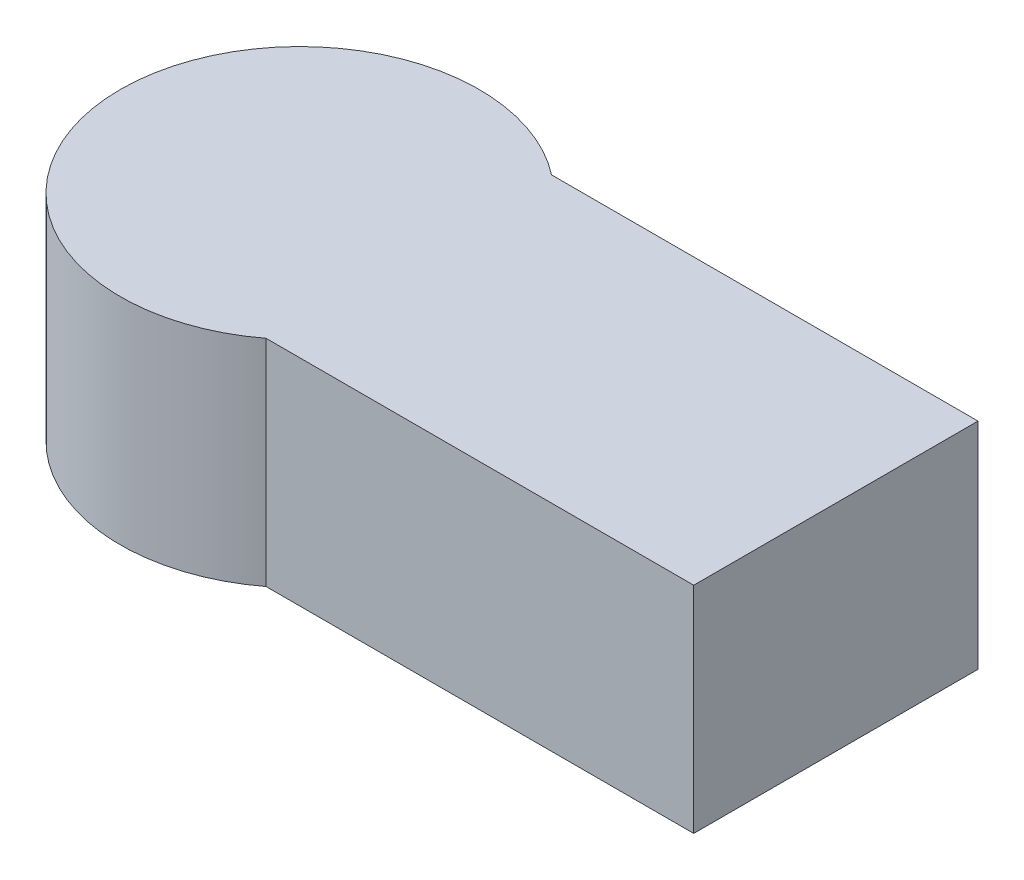
from build123d import *
from build123d.topology import SkipClean

# Parameters (mm, degrees)
SALIENTE_EXTRUIR1_DEPTH = 65
SALIENTE_EXTRUIR2_DEPTH = 2.5
CROQUIS4_W              = 101
CROQUIS4_H              = 10
CORTAR_EXTRUIR1_DEPTH   = 250
SALIENTE_EXTRUIR3_DEPTH = 3


with BuildPart() as part:
    # Croquis2 → Saliente-Extruir1 (new body)
    with BuildSketch(Plane(origin=(0, 0, 0), x_dir=(1, 0, 0), z_dir=(0, 1, 0))):
        with BuildLine():
            Line((151, 39.865398531), (31, 39.865398531))
            ThreePointArc((31, 39.865398531), (-50.499518563, 0.220510468), (30.650673156, -40.134601469))
            Line((30.650673156, -40.134601469), (151, -40.134601469))
            Line((151, -40.134601469), (151, 39.865398531))
        make_face()
        with BuildLine():
            Line((30.655028903, 38.865398531), (150, 38.865398531))
            Line((150, 38.865398531), (150, -39.134601469))
            Line((150, -39.134601469), (30.310608173, -39.134601469))
            ThreePointArc((30.310608173, -39.134601469), (-49.499517432, 0.218572563), (30.655028903, 38.865398531))
        make_face(mode=Mode.SUBTRACT)
    extrude(amount=SALIENTE_EXTRUIR1_DEPTH)

    # Croquis3 → Saliente-Extruir2 (add)
    with SkipClean():  # the faces are left unmerged after this step: merging them gives an invalid solid
        with BuildSketch(Plane(origin=(0, 65, 0), x_dir=(1, 0, 0), z_dir=(0, 1, 0))):
            with BuildLine():
                Line((151, 39.865398531), (151, -40.134601469))
                Line((151, -40.134601469), (30.650673156, -40.134601469))
                ThreePointArc((30.650673156, -40.134601469), (-50.499518563, 0.220510468), (31, 39.865398531))
                Line((31, 39.865398531), (151, 39.865398531))
            make_face()
        extrude(amount=SALIENTE_EXTRUIR2_DEPTH)

    # Croquis4 → Cortar-Extruir1 (cut)
    with BuildSketch(Plane(origin=(151, 0, 0), x_dir=(0, 0, -1), z_dir=(1, 0, 0))):
        with Locations((0, 62.5)):
            Rectangle(CROQUIS4_W, CROQUIS4_H)
    extrude(amount=-CORTAR_EXTRUIR1_DEPTH, mode=Mode.SUBTRACT)

    # Croquis5 → Saliente-Extruir3 (add)
    with BuildSketch(Plane(origin=(0, 57.5, 0), x_dir=(1, 0, 0), z_dir=(0, 1, 0))):
        with BuildLine():
            Line((151, 39.865398531), (31, 39.865398531))
            ThreePointArc((31, 39.865398531), (-50.499518563, 0.220510468), (30.650673156, -40.134601469))
            Line((30.650673156, -40.134601469), (151, -40.134601469))
            Line((151, -40.134601469), (151, 39.865398531))
        make_face()
    extrude(amount=SALIENTE_EXTRUIR3_DEPTH)


solid = part.part
